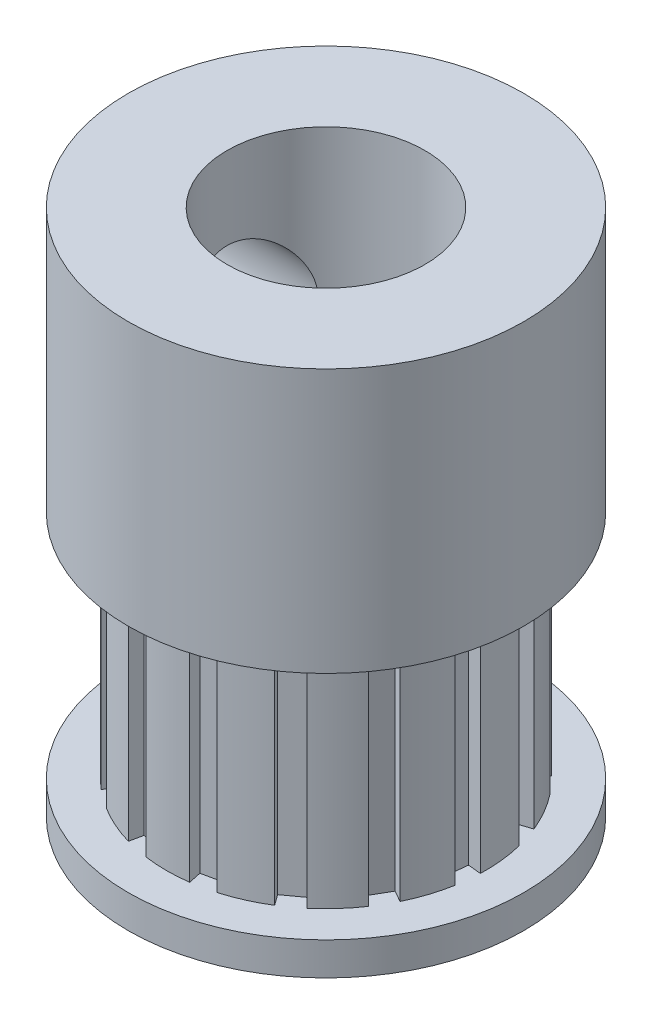
from build123d import *

# Parameters (mm, degrees)
SKETCH_1_R               = 6
EXTRUDE_1_DEPTH          = 1
EXTRUDE_2_DEPTH          = 7
SKETCH_3_R               = 6
EXTRUDE_3_DEPTH          = 8
CUT_EXTRUDE_1_REACH      = 20.111
SKETCH_4_R               = 3
CUT_EXTRUDE_2_REACH      = 20.111
CUT_EXTRUDE_2_END_RADIUS = 6
SKETCH_5_R               = 2


with BuildPart() as part:
    # 草图1 → 凸台-拉伸1 (new body)
    with BuildSketch(Plane(origin=(0, 0, 0), x_dir=(1, 0, 0), z_dir=(0, 1, 0))):
        with Locations(Location((0, 0, 0), (0, 0, 270))):
            Circle(SKETCH_1_R)
    extrude(amount=EXTRUDE_1_DEPTH)

    # 草图2 → 凸台-拉伸2 (add)
    with BuildSketch(Plane(origin=(0, 1, 0), x_dir=(1, 0, 0), z_dir=(0, 1, 0))):
        with BuildLine():
            Line((-0.35, 4.427328454), (-0.35, 4.827328454))
            ThreePointArc((-0.35, 4.827328454), (-1.006292584, 4.734234388), (-1.64371046, 4.552341807))
            Line((-1.64371046, 4.552341807), (-1.481015803, 4.186923623))
            Line((-1.481015803, 4.186923623), (-2.120497623, 3.902207973))
            Line((-2.120497623, 3.902207973), (-2.28319228, 4.267626156))
            ThreePointArc((-2.28319228, 4.267626156), (-2.844880621, 3.915642253), (-3.353208449, 3.490213904))
            Line((-3.353208449, 3.490213904), (-3.055950519, 3.222561662))
            Line((-3.055950519, 3.222561662), (-3.524341943, 2.702360284))
            Line((-3.524341943, 2.702360284), (-3.821599873, 2.970012526))
            ThreePointArc((-3.821599873, 2.970012526), (-4.191562954, 2.42), (-4.482906234, 1.82459631))
            Line((-4.482906234, 1.82459631), (-4.102483628, 1.700989513))
            Line((-4.102483628, 1.700989513), (-4.318795524, 1.035249951))
            Line((-4.318795524, 1.035249951), (-4.69921813, 1.158856749))
            ThreePointArc((-4.69921813, 1.158856749), (-4.813485974, 0.505917762), (-4.837468805, -0.156510562))
            Line((-4.837468805, -0.156510562), (-4.439660047, -0.114699176))
            Line((-4.439660047, -0.114699176), (-4.366490123, -0.810864503))
            Line((-4.366490123, -0.810864503), (-4.764298881, -0.852675888))
            ThreePointArc((-4.764298881, -0.852675888), (-4.603113539, -1.495642253), (-4.355589073, -2.110555336))
            Line((-4.355589073, -2.110555336), (-4.009178912, -1.910555336))
            Line((-4.009178912, -1.910555336), (-3.659178912, -2.516773118))
            Line((-3.659178912, -2.516773118), (-4.005589073, -2.716773118))
            ThreePointArc((-4.005589073, -2.716773118), (-3.596820955, -3.238592135), (-3.120588421, -3.699665918))
            Line((-3.120588421, -3.699665918), (-2.88547432, -3.37605912))
            Line((-2.88547432, -3.37605912), (-2.319162424, -3.787508797))
            Line((-2.319162424, -3.787508797), (-2.554276525, -4.111115595))
            ThreePointArc((-2.554276525, -4.111115595), (-1.968605352, -4.421560015), (-1.346009681, -4.649070653))
            Line((-1.346009681, -4.649070653), (-1.262845005, -4.257811613))
            Line((-1.262845005, -4.257811613), (-0.578141684, -4.403349796))
            Line((-0.578141684, -4.403349796), (-0.661306361, -4.794608837))
            ThreePointArc((-0.661306361, -4.794608837), (0, -4.84), (0.661306361, -4.794608837))
            Line((0.661306361, -4.794608837), (0.578141684, -4.403349796))
            Line((0.578141684, -4.403349796), (1.262845005, -4.257811613))
            Line((1.262845005, -4.257811613), (1.346009681, -4.649070653))
            ThreePointArc((1.346009681, -4.649070653), (1.968605352, -4.421560015), (2.554276525, -4.111115595))
            Line((2.554276525, -4.111115595), (2.319162424, -3.787508797))
            Line((2.319162424, -3.787508797), (2.88547432, -3.37605912))
            Line((2.88547432, -3.37605912), (3.120588421, -3.699665918))
            ThreePointArc((3.120588421, -3.699665918), (3.596820955, -3.238592135), (4.005589073, -2.716773118))
            Line((4.005589073, -2.716773118), (3.659178912, -2.516773118))
            Line((3.659178912, -2.516773118), (4.009178912, -1.910555336))
            Line((4.009178912, -1.910555336), (4.355589073, -2.110555336))
            ThreePointArc((4.355589073, -2.110555336), (4.603113539, -1.495642253), (4.764298881, -0.852675888))
            Line((4.764298881, -0.852675888), (4.366490123, -0.810864503))
            Line((4.366490123, -0.810864503), (4.439660047, -0.114699176))
            Line((4.439660047, -0.114699176), (4.837468805, -0.156510562))
            ThreePointArc((4.837468805, -0.156510562), (4.813485974, 0.505917762), (4.69921813, 1.158856749))
            Line((4.69921813, 1.158856749), (4.318795524, 1.035249951))
            Line((4.318795524, 1.035249951), (4.102483628, 1.700989513))
            Line((4.102483628, 1.700989513), (4.482906234, 1.82459631))
            ThreePointArc((4.482906234, 1.82459631), (4.191562954, 2.42), (3.821599873, 2.970012526))
            Line((3.821599873, 2.970012526), (3.524341943, 2.702360284))
            Line((3.524341943, 2.702360284), (3.055950519, 3.222561662))
            Line((3.055950519, 3.222561662), (3.353208449, 3.490213904))
            ThreePointArc((3.353208449, 3.490213904), (2.844880621, 3.915642253), (2.28319228, 4.267626156))
            Line((2.28319228, 4.267626156), (2.120497623, 3.902207973))
            Line((2.120497623, 3.902207973), (1.481015803, 4.186923623))
            Line((1.481015803, 4.186923623), (1.64371046, 4.552341807))
            ThreePointArc((1.64371046, 4.552341807), (1.006292584, 4.734234388), (0.35, 4.827328454))
            Line((0.35, 4.827328454), (0.35, 4.427328454))
            Line((0.35, 4.427328454), (-0.35, 4.427328454))
        make_face()
    extrude(amount=EXTRUDE_2_DEPTH)

    # 草图3 → 凸台-拉伸3 (add)
    with BuildSketch(Plane(origin=(0, 8, 0), x_dir=(1, 0, 0), z_dir=(0, 1, 0))):
        with Locations(Location((0, 0, 0), (0, 0, 270))):
            Circle(SKETCH_3_R)
    extrude(amount=EXTRUDE_3_DEPTH)

    # 草图4 → 切除-拉伸1 (cut, up to next)
    with BuildSketch(Plane(origin=(0, 16, 0), x_dir=(1, 0, 0), z_dir=(0, 1, 0)), mode=Mode.PRIVATE) as cut_extrude_1_sk1:
        with Locations(Location((0, 0, 0), (0, 0, 270))):
            Circle(SKETCH_4_R)
    cut_extrude_1_tool1 = extrude(cut_extrude_1_sk1.sketch, amount=-CUT_EXTRUDE_1_REACH, mode=Mode.PRIVATE) & part.part
    add(cut_extrude_1_tool1.solids().sort_by_distance((0, 16, 0))[0], mode=Mode.SUBTRACT)

    # 切除-拉伸2: up to this cylinder (the profile starts inside it)
    cut_extrude_2_end = Plane(origin=(0, 11.5, 0), z_dir=(0, -1, 0)) * Cylinder(CUT_EXTRUDE_2_END_RADIUS, 53.222, mode=Mode.PRIVATE)
    # 草图5 → 切除-拉伸2 (cut, up to the surface)
    with BuildSketch(Plane(origin=(0, 0, 0), x_dir=(0, 0, -1), z_dir=(1, 0, 0)), mode=Mode.PRIVATE) as cut_extrude_2_sk1:
        with Locations((0, 11.5)):
            Circle(SKETCH_5_R)
    cut_extrude_2_tool1 = extrude(cut_extrude_2_sk1.sketch, amount=-CUT_EXTRUDE_2_REACH, mode=Mode.PRIVATE) & cut_extrude_2_end
    add(cut_extrude_2_tool1.solids().sort_by_distance((0, 11.5, 0))[0], mode=Mode.SUBTRACT)


solid = part.part
